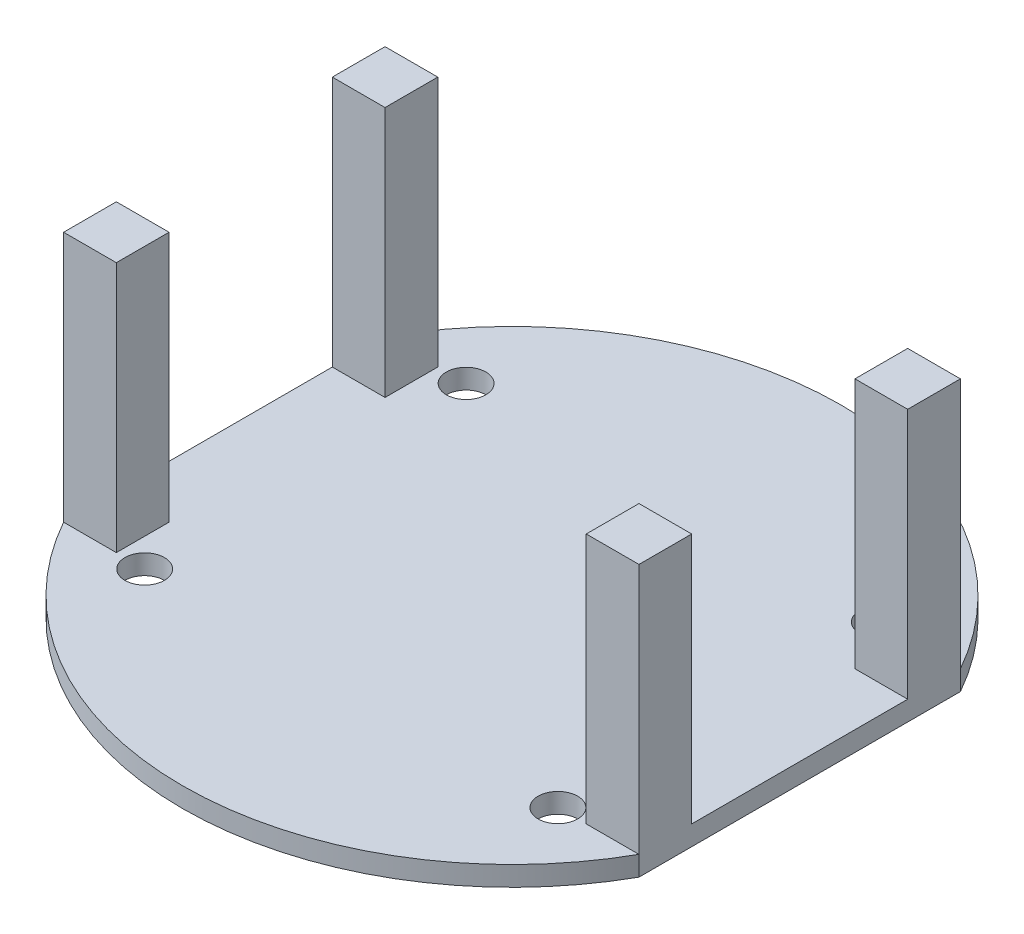
from build123d import *

# Parameters (mm, degrees)
SKETCH2_R           = 50
BOSS_EXTRUDE1_DEPTH = 3
CUT_EXTRUDE1_DEPTH  = 38.1
SKETCH9_W           = 8
SKETCH9_H           = 8
BOSS_EXTRUDE2_DEPTH = 38.1
SKETCH10_R          = 3
CUT_EXTRUDE2_DEPTH  = 3


with BuildPart() as part:
    # Sketch2 → Boss-Extrude1 (new body)
    with BuildSketch(Plane(origin=(0, 0, 0), x_dir=(1, 0, 0), z_dir=(0, 1, 0))):
        with Locations(Location((0, 0, 0), (0, 0, 270))):
            Circle(SKETCH2_R)
    extrude(amount=BOSS_EXTRUDE1_DEPTH)

    # Sketch6 → Cut-Extrude1 (cut)
    with BuildSketch(Plane(origin=(0, 3, 0), x_dir=(1, 0, 0), z_dir=(0, 1, 0))):
        Polygon((-43.65, 24.386010334), (-43.65, -24.386010334), (-50, -24.386010334), (-50, 0), (-50, 24.386010334), align=None)
        Polygon((43.65, 24.386010334), (43.65, -24.386010334), (50, -24.386010334), (50, 0), (50, 24.386010334), align=None)
    extrude(amount=-CUT_EXTRUDE1_DEPTH, mode=Mode.SUBTRACT)

    # Sketch9 → Boss-Extrude2 (add)
    with BuildSketch(Plane(origin=(0, 3, 0), x_dir=(1, 0, 0), z_dir=(0, 1, 0))):
        with Locations((-39.65, 20.386010334)):
            Rectangle(SKETCH9_W, SKETCH9_H)
        with Locations((39.65, 20.386010334)):
            Rectangle(SKETCH9_W, SKETCH9_H)
        with Locations((39.65, -20.386010334)):
            Rectangle(SKETCH9_W, SKETCH9_H)
        with Locations((-39.65, -20.386010334)):
            Rectangle(SKETCH9_W, SKETCH9_H)
    extrude(amount=BOSS_EXTRUDE2_DEPTH)

    # Sketch10 → Cut-Extrude2 (cut)
    with BuildSketch(Plane(origin=(0, 0, 0), x_dir=(-1, 0, 0), z_dir=(0, -1, 0))):
        with Locations(Location((31.35, -24.386010334, 0), (0, 0, 90))):
            Circle(SKETCH10_R)
        with Locations(Location((31.35, 24.386010334, 0), (0, 0, 90))):
            Circle(SKETCH10_R)
        with Locations(Location((-31.35, 24.386010334, 0), (0, 0, 90))):
            Circle(SKETCH10_R)
        with Locations(Location((-31.35, -24.386010334, 0), (0, 0, 90))):
            Circle(SKETCH10_R)
    extrude(amount=-CUT_EXTRUDE2_DEPTH, mode=Mode.SUBTRACT)


solid = part.part
